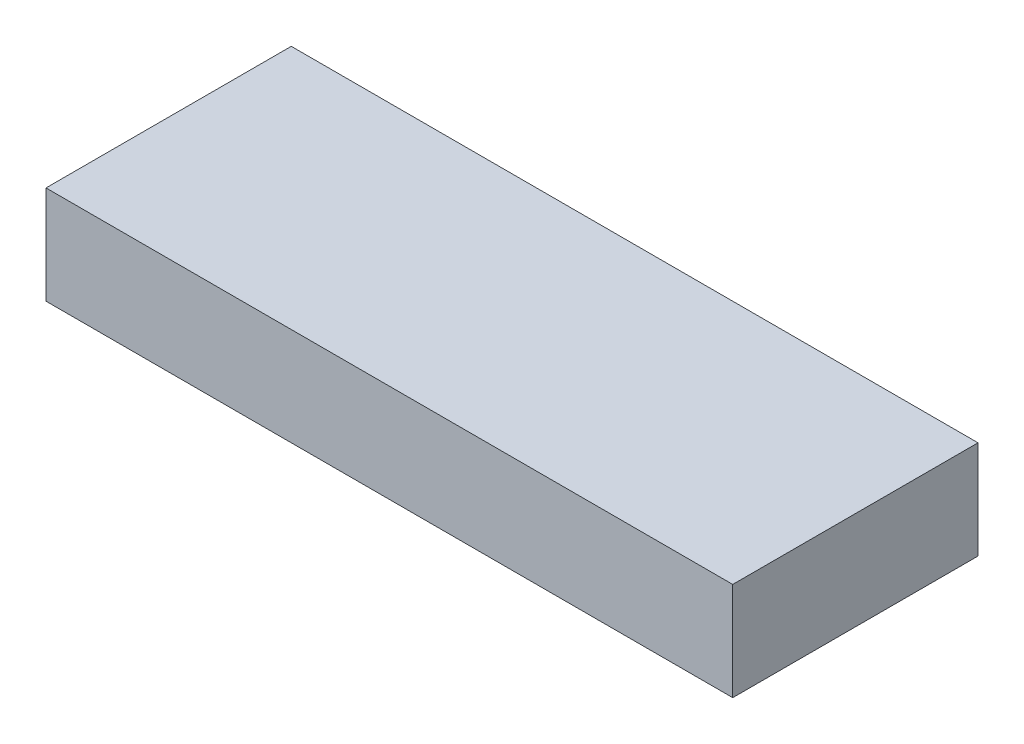
from build123d import *

# Parameters (mm, degrees)
SKETCH1_W           = 88.9
SKETCH1_H           = 31.75
BOSS_EXTRUDE1_DEPTH = 12.7


with BuildPart() as part:
    # Sketch1 → Boss-Extrude1 (new body)
    with BuildSketch(Plane(origin=(0, 0, 0), x_dir=(1, 0, 0), z_dir=(0, 1, 0))):
        Rectangle(SKETCH1_W, SKETCH1_H)
    extrude(amount=BOSS_EXTRUDE1_DEPTH)


solid = part.part
